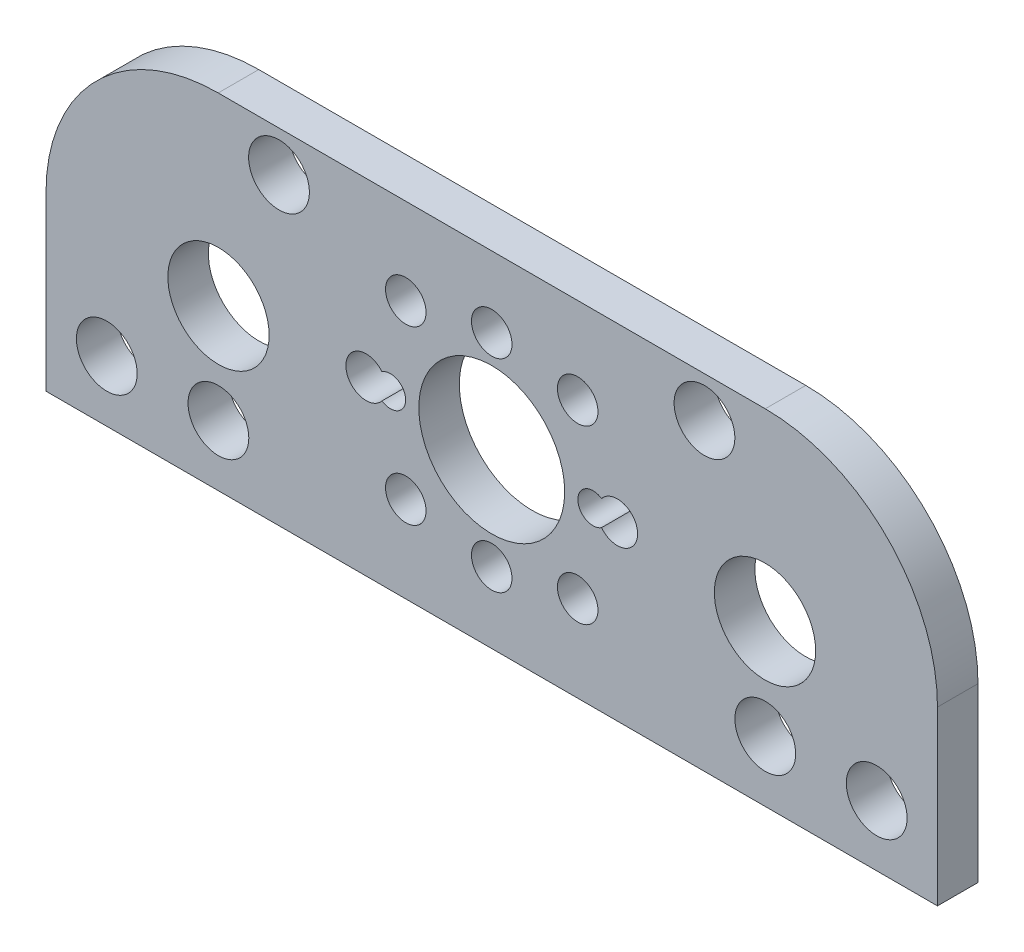
from build123d import *

# Parameters (mm, degrees)
EXTRUDE_1_DEPTH     = 2
SKETCH_6_R          = 1
SKETCH_6_R_2        = 3.6
CUT_EXTRUDE_1_DEPTH = 2
SKETCH_8_R          = 2.5
CUT_EXTRUDE_2_DEPTH = 2
SKETCH_12_R         = 1.5
CUT_EXTRUDE_3_DEPTH = 10


with BuildPart() as part:
    # 草图10 → 凸台-拉伸1 (new body)
    with BuildSketch(Plane.XY):
        with BuildLine():
            Line((-13.5, 8.5), (13.5, 8.5))
            ThreePointArc((13.5, 8.5), (19.51040764, 6.01040764), (22, 0))
            Line((22, 0), (22, -8.5))
            Line((22, -8.5), (-22, -8.5))
            Line((-22, -8.5), (-22, 0))
            ThreePointArc((-22, 0), (-19.51040764, 6.01040764), (-13.5, 8.5))
        make_face()
    extrude(amount=-EXTRUDE_1_DEPTH)

    # 草图6 → 切除-拉伸1 (cut)
    with BuildSketch(Plane.XY):
        with Locations((0, 5)):
            Circle(SKETCH_6_R)
        with Locations((0, -5)):
            Circle(SKETCH_6_R)
        Circle(SKETCH_6_R_2)
        with Locations((-4.242640687, 4.242640687)):
            Circle(SKETCH_6_R)
        with Locations((4.242640687, 4.242640687)):
            Circle(SKETCH_6_R)
        with Locations((-4.242640687, -4.242640687)):
            Circle(SKETCH_6_R)
        with Locations((4.242640687, -4.242640687)):
            Circle(SKETCH_6_R)
        with BuildLine():
            ThreePointArc((-5.417708333, -0.622912312), (-4.25, 0), (-5.417708333, 0.622912312))
            ThreePointArc((-5.417708333, 0.622912312), (-7.2, 0), (-5.417708333, -0.622912312))
        make_face()
        with BuildLine():
            ThreePointArc((5.417708333, 0.622912312), (4.25, 0), (5.417708333, -0.622912312))
            ThreePointArc((5.417708333, -0.622912312), (7.2, 0), (5.417708333, 0.622912312))
        make_face()
    extrude(amount=-CUT_EXTRUDE_1_DEPTH, mode=Mode.SUBTRACT)

    # 草图8 → 切除-拉伸2 (cut)
    with BuildSketch(Plane.XY):
        with Locations((-13.486660076, -0.6)):
            Circle(SKETCH_8_R)
        with Locations((13.486660076, -0.6)):
            Circle(SKETCH_8_R)
    extrude(amount=-CUT_EXTRUDE_2_DEPTH, mode=Mode.SUBTRACT)

    # 草图12 → 切除-拉伸3 (cut)
    with BuildSketch(Plane.XY):
        with Locations((-19, -5.5)):
            Circle(SKETCH_12_R)
        with Locations((19, -5.5)):
            Circle(SKETCH_12_R)
        with Locations((-10.5, 6.5)):
            Circle(SKETCH_12_R)
        with Locations((10.5, 6.5)):
            Circle(SKETCH_12_R)
        with Locations((-13.490737563, -5.5)):
            Circle(SKETCH_12_R)
        with Locations((13.5, -5.5)):
            Circle(SKETCH_12_R)
    extrude(amount=-CUT_EXTRUDE_3_DEPTH, mode=Mode.SUBTRACT)


solid = part.part
